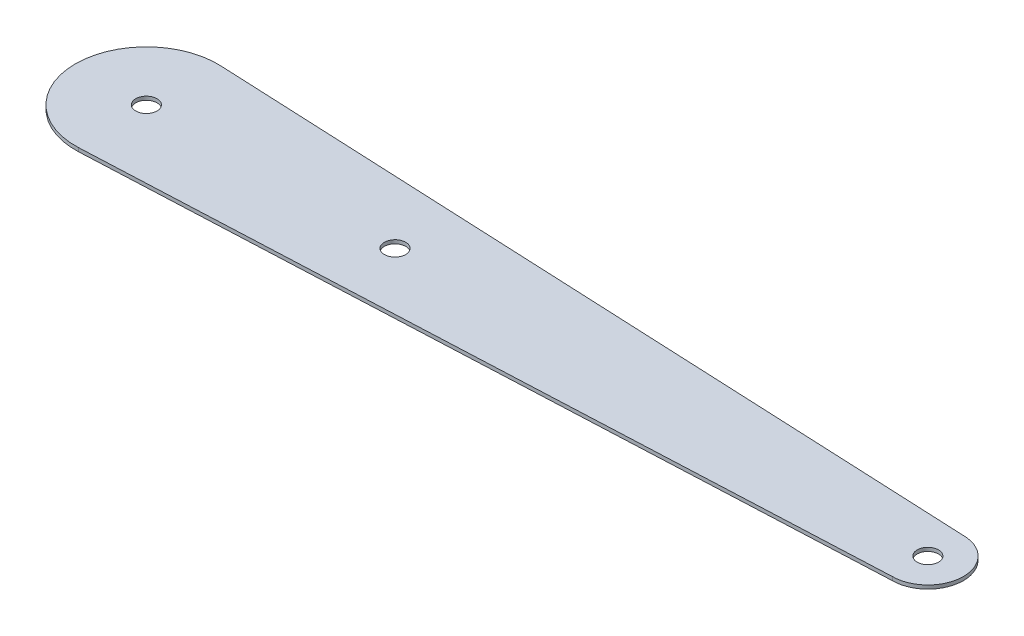
from build123d import *

# Parameters (mm, degrees)
BOSS_EXTRUDE1_DEPTH = 2.54
SKETCH2_R           = 7.5
CUT_EXTRUDE1_DEPTH  = 10


with BuildPart() as part:
    # Sketch1 → Boss-Extrude1 (new body)
    with BuildSketch(Plane(origin=(0, 0, 0), x_dir=(1, 0, 0), z_dir=(0, 1, 0))):
        with BuildLine():
            Line((-247.724918783, 49.948213236), (300, 25))
            ThreePointArc((300, 25), (325, 0), (300, -25))
            Line((300, -25), (-247.724918783, -49.948213236))
            ThreePointArc((-247.724918783, -49.948213236), (-300, 0), (-247.724918783, 49.948213236))
        make_face()
    extrude(amount=BOSS_EXTRUDE1_DEPTH)

    # Sketch2 → Cut-Extrude1 (cut)
    with BuildSketch(Plane(origin=(0, 2.54, 0), x_dir=(1, 0, 0), z_dir=(0, 1, 0))):
        with Locations(Location((-75, 0, 0), (0, 0, 270))):
            Circle(SKETCH2_R)
        with Locations(Location((300, 0, 0), (0, 0, 270))):
            Circle(SKETCH2_R)
        with Locations(Location((-250, 0, 0), (0, 0, 270))):
            Circle(SKETCH2_R)
    extrude(amount=-CUT_EXTRUDE1_DEPTH, mode=Mode.SUBTRACT)


solid = part.part
